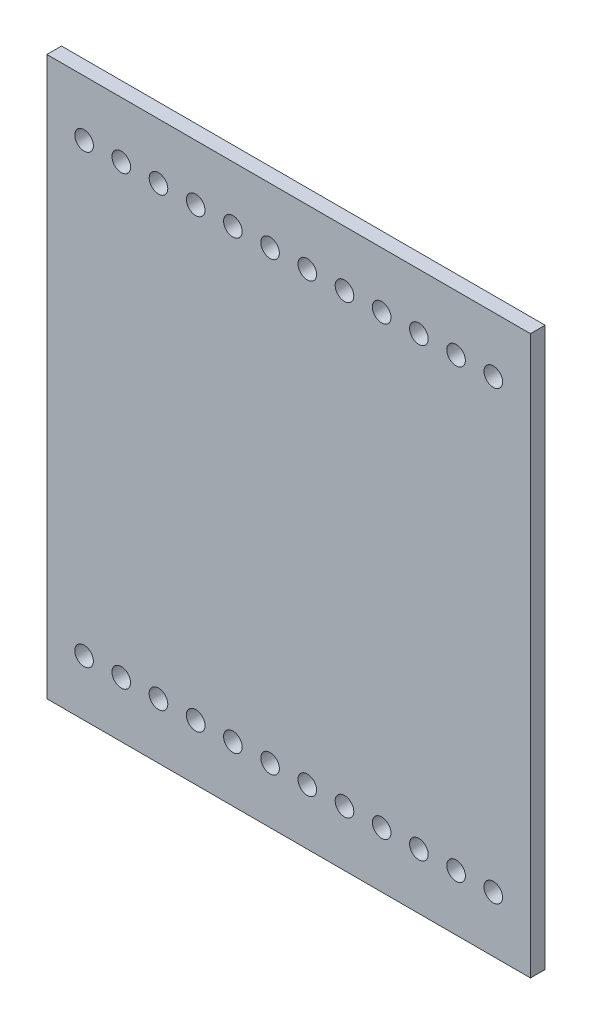
from build123d import *

# Parameters (mm, degrees)
CROQUIS1_W              = 33.02
CROQUIS1_H              = 38.1
SALIENTE_EXTRUIR1_DEPTH = 1
CROQUIS2_R              = 0.635
CORTAR_EXTRUIR1_DEPTH   = 26.228606779


with BuildPart() as part:
    # Croquis1 → Saliente-Extruir1 (new body)
    with BuildSketch(Plane.XY):
        Rectangle(CROQUIS1_W, CROQUIS1_H)
    extrude(amount=SALIENTE_EXTRUIR1_DEPTH)

    # Croquis2 → Cortar-Extruir1 (cut, through all)
    with BuildSketch(Plane.XY.offset(1)):
        with Locations((-13.97, 15.24)):
            Circle(CROQUIS2_R)
        with Locations((-11.43, 15.24)):
            Circle(CROQUIS2_R)
        with Locations((-8.89, 15.24)):
            Circle(CROQUIS2_R)
        with Locations((-6.35, 15.24)):
            Circle(CROQUIS2_R)
        with Locations((-3.81, 15.24)):
            Circle(CROQUIS2_R)
        with Locations((-1.27, 15.24)):
            Circle(CROQUIS2_R)
        with Locations((1.27, 15.24)):
            Circle(CROQUIS2_R)
        with Locations((3.81, 15.24)):
            Circle(CROQUIS2_R)
        with Locations((6.35, 15.24)):
            Circle(CROQUIS2_R)
        with Locations((8.89, 15.24)):
            Circle(CROQUIS2_R)
        with Locations((11.43, 15.24)):
            Circle(CROQUIS2_R)
        with Locations((13.97, 15.24)):
            Circle(CROQUIS2_R)
        with Locations(Location((13.97, -15.24, 0), (0, 0, 180))):
            Circle(CROQUIS2_R)
        with Locations(Location((11.43, -15.24, 0), (0, 0, 180))):
            Circle(CROQUIS2_R)
        with Locations(Location((8.89, -15.24, 0), (0, 0, 180))):
            Circle(CROQUIS2_R)
        with Locations(Location((6.35, -15.24, 0), (0, 0, 180))):
            Circle(CROQUIS2_R)
        with Locations(Location((3.81, -15.24, 0), (0, 0, 180))):
            Circle(CROQUIS2_R)
        with Locations(Location((1.27, -15.24, 0), (0, 0, 180))):
            Circle(CROQUIS2_R)
        with Locations(Location((-1.27, -15.24, 0), (0, 0, 180))):
            Circle(CROQUIS2_R)
        with Locations(Location((-3.81, -15.24, 0), (0, 0, 180))):
            Circle(CROQUIS2_R)
        with Locations(Location((-6.35, -15.24, 0), (0, 0, 180))):
            Circle(CROQUIS2_R)
        with Locations(Location((-8.89, -15.24, 0), (0, 0, 180))):
            Circle(CROQUIS2_R)
        with Locations(Location((-11.43, -15.24, 0), (0, 0, 180))):
            Circle(CROQUIS2_R)
        with Locations(Location((-13.97, -15.24, 0), (0, 0, 180))):
            Circle(CROQUIS2_R)
    extrude(amount=-CORTAR_EXTRUIR1_DEPTH, mode=Mode.SUBTRACT)


solid = part.part
